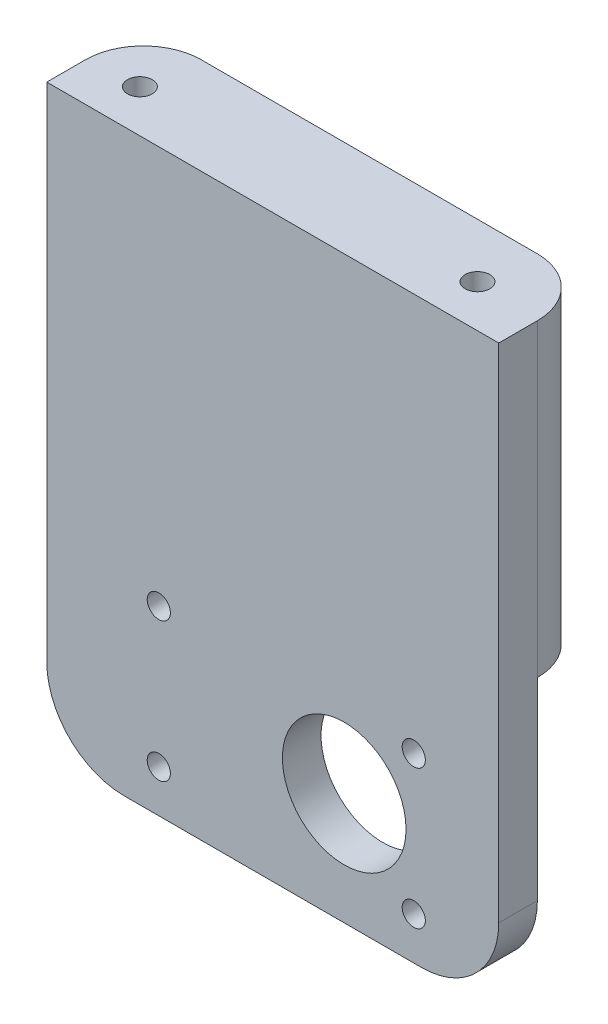
from build123d import *

# Parameters (mm, degrees)
SKETCH1_W                = 58.5
SKETCH1_H                = 75
SKETCH1_R                = 8
SKETCH1_R_2              = 1.5
BOSS_EXTRUDE1_DEPTH      = 2.5
SKETCH4_W                = 58.5
SKETCH4_H                = 40
BOSS_EXTRUDE2_DEPTH      = 7.5
M3_CLEARANCE_HOLE1_D     = 3.2
M3_CLEARANCE_HOLE1_DEPTH = 4
M3_CLEARANCE_HOLE1_TIP   = 0.96137699
FILLET1_R                = 10
FILLET2_R                = 7.5


with BuildPart() as part:
    # Sketch1 → Boss-Extrude1 (new, symmetric)
    with BuildSketch(Plane.XY):
        with Locations((-9.25, 23)):
            Rectangle(SKETCH1_W, SKETCH1_H)
        Circle(SKETCH1_R, mode=Mode.SUBTRACT)
        with Locations((-24, -9)):
            Circle(SKETCH1_R_2, mode=Mode.SUBTRACT)
        with Locations((9, -9)):
            Circle(SKETCH1_R_2, mode=Mode.SUBTRACT)
        with Locations((9, 9)):
            Circle(SKETCH1_R_2, mode=Mode.SUBTRACT)
        with Locations((-24, 9)):
            Circle(SKETCH1_R_2, mode=Mode.SUBTRACT)
    extrude(amount=BOSS_EXTRUDE1_DEPTH, both=True)

    # Sketch4 → Boss-Extrude2 (add)
    with BuildSketch(Plane(origin=(0, 0, -2.5), x_dir=(-1, 0, 0), z_dir=(0, 0, -1))):
        with Locations((9.25, 40.5)):
            Rectangle(SKETCH4_W, SKETCH4_H)
    extrude(amount=BOSS_EXTRUDE2_DEPTH)

    # M3 Clearance Hole1
    with Locations(Plane(origin=(0, 60.5, 0), x_dir=(1, 0, 0), z_dir=(0, 1, 0))):
        with Locations((-31.95, 3), (11.75, 3)):
            Hole(M3_CLEARANCE_HOLE1_D / 2, depth=M3_CLEARANCE_HOLE1_DEPTH)
            with Locations((0, 0, -(M3_CLEARANCE_HOLE1_DEPTH + M3_CLEARANCE_HOLE1_TIP / 2))):  # 118° drill point
                Cone(0, M3_CLEARANCE_HOLE1_D / 2, M3_CLEARANCE_HOLE1_TIP, mode=Mode.SUBTRACT)

    # Fillet1
    fillet1_edges = [part.edges().sort_by_distance(p)[0] for p in [
        (20, -14.5, 0),
        (-38.5, -14.5, 0),
    ]]
    fillet(fillet1_edges, radius=FILLET1_R)

    # Fillet2
    fillet2_edges = [part.edges().sort_by_distance(p)[0] for p in [
        (-38.5, 40.5, -10),
        (20, 40.5, -10),
    ]]
    fillet(fillet2_edges, radius=FILLET2_R)


solid = part.part
